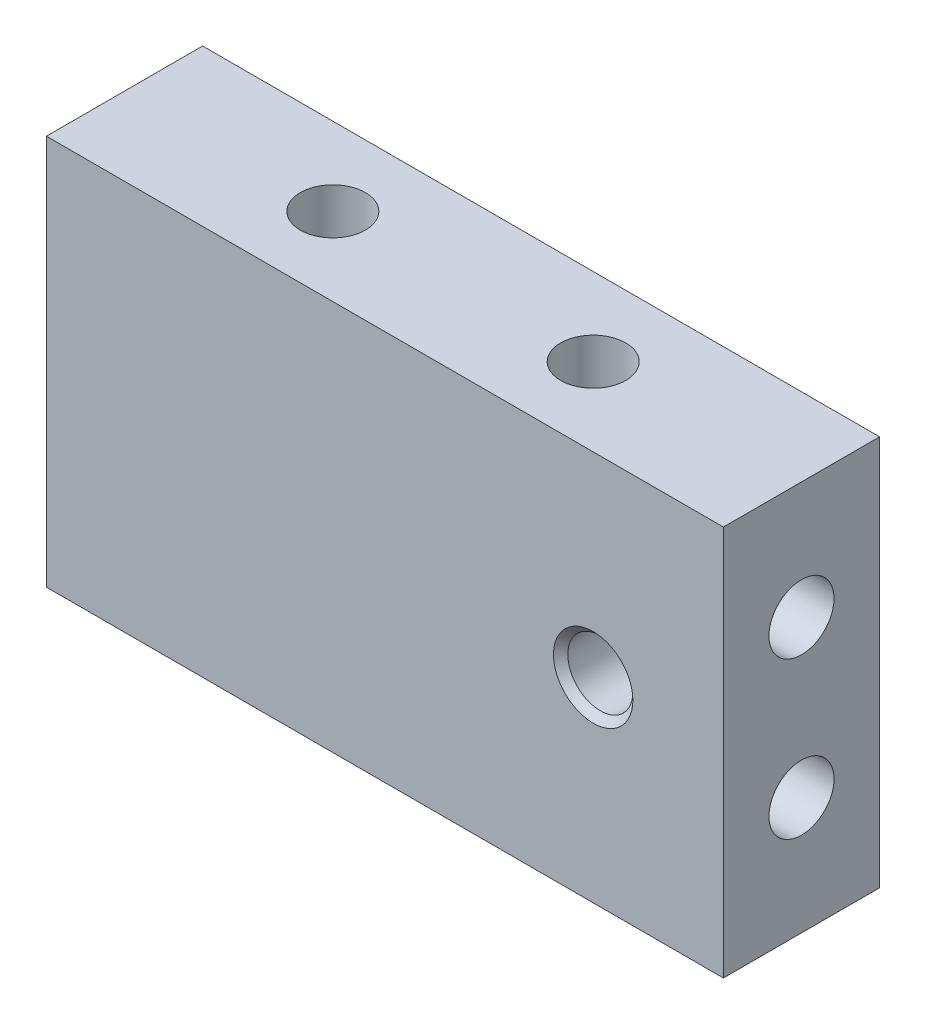
from build123d import *

# Parameters (mm, degrees)
SKETCH_1_W                   = 26
SKETCH_1_H                   = 15
EXTRUDE_1_DEPTH              = 5
SKETCH_2_W                   = 26
SKETCH_2_H                   = 15
EXTRUDE_2_DEPTH              = 1
HOLE_WIZARD_M3_1_AT_2_COUNT  = 2
HOLE_WIZARD_M3_1_AT_2_PITCH  = 6
HOLE_WIZARD_M3_2_D           = 2.5
HOLE_WIZARD_M3_2_DEPTH       = 7
HOLE_WIZARD_M3_2_TIP         = 0.751075774
HOLE_WIZARD_M3_3_D           = 2.5
HOLE_WIZARD_M3_3_CSINK_D     = 3.05
HOLE_WIZARD_M3_3_CSINK_ANGLE = 90


with BuildPart() as part:
    # 草图1 → 凸台-拉伸1 (new body)
    with BuildSketch(Plane.XY):
        Rectangle(SKETCH_1_W, SKETCH_1_H)
    extrude(amount=EXTRUDE_1_DEPTH)

    # 草图2 → 凸台-拉伸2 (add)
    with BuildSketch(Plane.XY.offset(5)):
        Rectangle(SKETCH_2_W, SKETCH_2_H)
    extrude(amount=EXTRUDE_2_DEPTH)

    # 草图4 → M3 螺纹孔1 (revolve, cut)
    with BuildSketch(Plane(origin=(-13, -3, 3), x_dir=(0, 0, 1), z_dir=(0, 1, 0))):
        Polygon((0, 0), (0, 5.751075774), (1.25, 5), (1.25, 0), align=None)
    hole_wizard_m3_1 = revolve(axis=Axis((-19.35, -3, 3), (1, 0, 0)), mode=Mode.SUBTRACT)

    # M3 螺纹孔1 at 2: M3 螺纹孔1 ×2
    with Locations(*[(0, i * HOLE_WIZARD_M3_1_AT_2_PITCH, 0) for i in range(1, HOLE_WIZARD_M3_1_AT_2_COUNT)]):
        add(hole_wizard_m3_1, mode=Mode.SUBTRACT)

    # 镜向1: M3 螺纹孔1 across plane
    add(hole_wizard_m3_1.mirror(Plane(origin=(0, 0, 0), x_dir=(0, 0, 1), z_dir=(1, 0, 0))), mode=Mode.SUBTRACT)

    # 镜向1 copy 1 sketch → 镜向1 copy 1 (revolve, cut)
    with BuildSketch(Plane(origin=(13, 3, 3), x_dir=(0, 0, 1), z_dir=(0, 1, 0))):
        Polygon((0, 0), (0, -5.751075774), (1.25, -5), (1.25, 0), align=None)
    revolve(axis=Axis((19.35, 3, 3), (1, 0, 0)), mode=Mode.SUBTRACT)

    # M3 螺纹孔2
    with Locations(Plane(origin=(-5, 7.5, 3), x_dir=(0, 0, 1), z_dir=(0, 1, 0))):
        with Locations((0, 0), (0, 10)):
            Hole(HOLE_WIZARD_M3_2_D / 2, depth=HOLE_WIZARD_M3_2_DEPTH)
            with Locations((0, 0, -(HOLE_WIZARD_M3_2_DEPTH + HOLE_WIZARD_M3_2_TIP / 2))):  # 118° drill point
                Cone(0, HOLE_WIZARD_M3_2_D / 2, HOLE_WIZARD_M3_2_TIP, mode=Mode.SUBTRACT)

    # M3 螺纹孔3 (through all)
    with Locations(Plane.XY.offset(6)):
        with Locations((8, 0)):
            CounterSinkHole(HOLE_WIZARD_M3_3_D / 2, HOLE_WIZARD_M3_3_CSINK_D / 2, counter_sink_angle=HOLE_WIZARD_M3_3_CSINK_ANGLE)


solid = part.part
